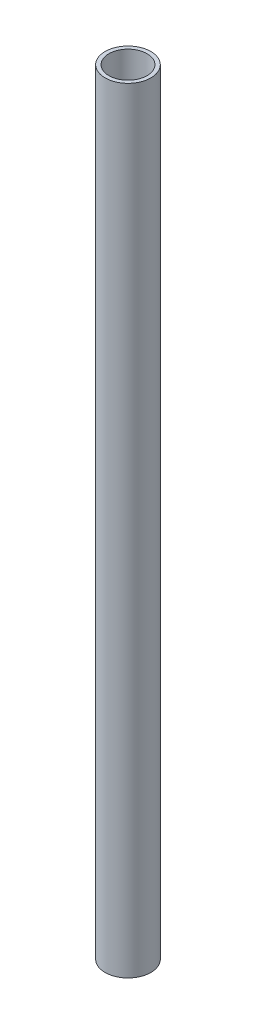
from build123d import *

# Parameters (mm, degrees)
SKETCH1_R           = 6
SKETCH1_R_2         = 5
BOSS_EXTRUDE1_DEPTH = 203.2


with BuildPart() as part:
    # Sketch1 → Boss-Extrude1 (new body)
    with BuildSketch(Plane(origin=(0, 0, 0), x_dir=(1, 0, 0), z_dir=(0, 1, 0))):
        with Locations(Location((0, 0, 0), (0, 0, 270))):
            Circle(SKETCH1_R)
        with Locations(Location((0, 0, 0), (0, 0, 270))):
            Circle(SKETCH1_R_2, mode=Mode.SUBTRACT)
    extrude(amount=BOSS_EXTRUDE1_DEPTH)


solid = part.part
